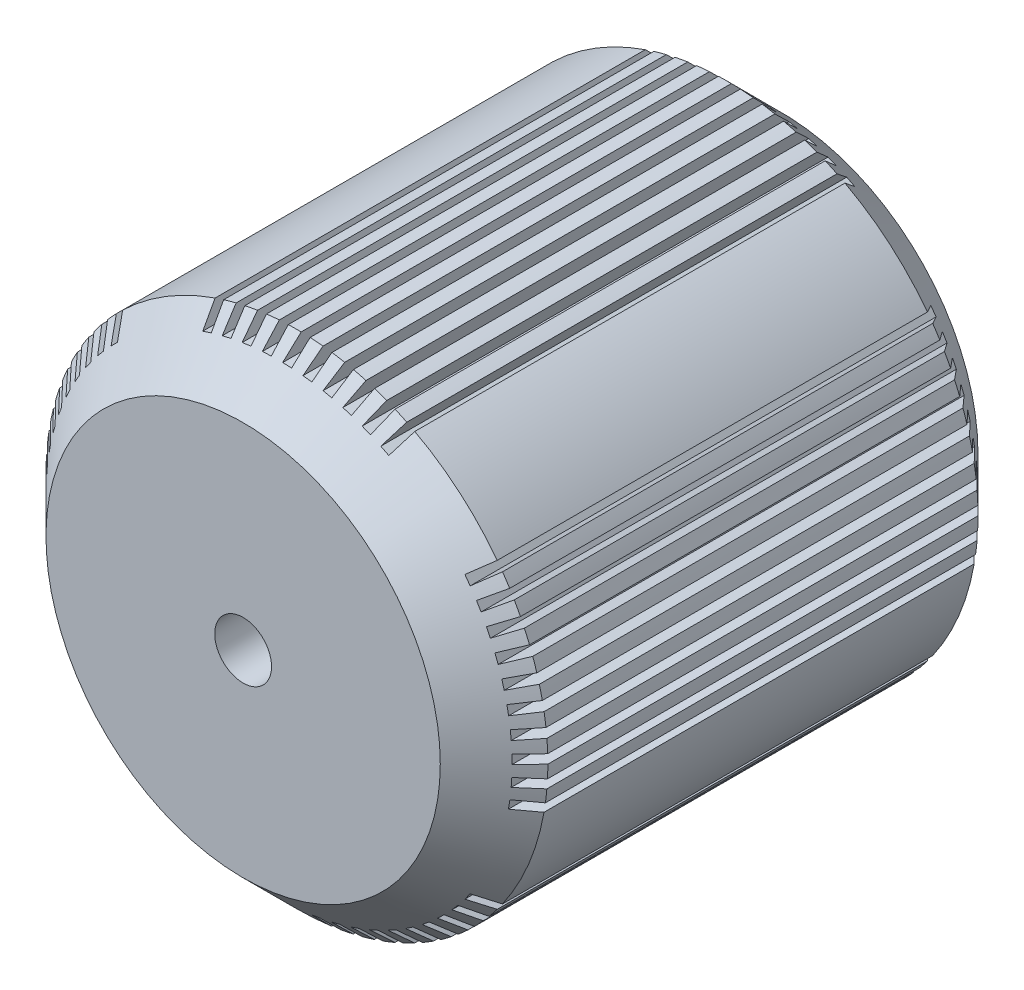
from build123d import *

# Parameters (mm, degrees)
ESQUISSE1_R                          = 14
BOSS_EXTRU_1_DEPTH                   = 30
CHANFREIN1_SIZE                      = 3
ESQUISSE2_R                          = 1.585
ENL_V_MAT_EXTRU_1_DEPTH              = 20
ENL_V_MAT_EXTRU_6_DEPTH              = 36.944401511
R_P_TITION_CIRCULAIRE1_COUNT         = 10
R_P_TITION_CIRCULAIRE1_ANGLE         = 45
R_P_TITION_CIRCULAIRE2_COUNT         = 5
R_P_TITION_CIRCULAIRE2_COPY_1_DEPTH  = 36.944401511
R_P_TITION_CIRCULAIRE2_COPY_2_DEPTH  = 36.944401511
R_P_TITION_CIRCULAIRE2_COPY_3_DEPTH  = 36.944401511
R_P_TITION_CIRCULAIRE2_COPY_4_DEPTH  = 36.944401511
R_P_TITION_CIRCULAIRE2_COPY_5_DEPTH  = 36.944401511
R_P_TITION_CIRCULAIRE2_COPY_6_DEPTH  = 36.944401511
R_P_TITION_CIRCULAIRE2_COPY_7_DEPTH  = 36.944401511
R_P_TITION_CIRCULAIRE2_COPY_8_DEPTH  = 36.944401511
R_P_TITION_CIRCULAIRE2_COPY_9_DEPTH  = 36.944401511
R_P_TITION_CIRCULAIRE2_COPY_10_DEPTH = 36.944401511
R_P_TITION_CIRCULAIRE2_COPY_11_DEPTH = 36.944401511
R_P_TITION_CIRCULAIRE2_COPY_12_DEPTH = 36.944401511
R_P_TITION_CIRCULAIRE2_COPY_13_DEPTH = 36.944401511
R_P_TITION_CIRCULAIRE2_COPY_14_DEPTH = 36.944401511
R_P_TITION_CIRCULAIRE2_COPY_15_DEPTH = 36.944401511
R_P_TITION_CIRCULAIRE2_COPY_16_DEPTH = 36.944401511
R_P_TITION_CIRCULAIRE2_COPY_17_DEPTH = 36.944401511
R_P_TITION_CIRCULAIRE2_COPY_18_DEPTH = 36.944401511
R_P_TITION_CIRCULAIRE2_COPY_19_DEPTH = 36.944401511
R_P_TITION_CIRCULAIRE2_COPY_20_DEPTH = 36.944401511
R_P_TITION_CIRCULAIRE2_COPY_21_DEPTH = 36.944401511
R_P_TITION_CIRCULAIRE2_COPY_22_DEPTH = 36.944401511
R_P_TITION_CIRCULAIRE2_COPY_23_DEPTH = 36.944401511
R_P_TITION_CIRCULAIRE2_COPY_24_DEPTH = 36.944401511
R_P_TITION_CIRCULAIRE2_COPY_25_DEPTH = 36.944401511
R_P_TITION_CIRCULAIRE2_COPY_26_DEPTH = 36.944401511
R_P_TITION_CIRCULAIRE2_COPY_27_DEPTH = 36.944401511
R_P_TITION_CIRCULAIRE2_COPY_28_DEPTH = 36.944401511
R_P_TITION_CIRCULAIRE2_COPY_29_DEPTH = 36.944401511
R_P_TITION_CIRCULAIRE2_COPY_30_DEPTH = 36.944401511
R_P_TITION_CIRCULAIRE2_COPY_31_DEPTH = 36.944401511
R_P_TITION_CIRCULAIRE2_COPY_32_DEPTH = 36.944401511
R_P_TITION_CIRCULAIRE2_COPY_33_DEPTH = 36.944401511
R_P_TITION_CIRCULAIRE2_COPY_34_DEPTH = 36.944401511
R_P_TITION_CIRCULAIRE2_COPY_35_DEPTH = 36.944401511
R_P_TITION_CIRCULAIRE2_COPY_36_DEPTH = 36.944401511


with BuildPart() as part:
    # Esquisse1 → Boss.-Extru.1 (new body)
    with BuildSketch(Plane.XY):
        Circle(ESQUISSE1_R)
    extrude(amount=BOSS_EXTRU_1_DEPTH)

    # Chanfrein1
    chanfrein1_edges = [part.edges().sort_by_distance(p)[0] for p in [
        (-14, 0, 0),
        (-14, 0, 30),
    ]]
    chamfer(chanfrein1_edges, length=CHANFREIN1_SIZE)

    # Esquisse2 → Enlèv. mat.-Extru.1 (cut)
    with BuildSketch(Plane.XY.offset(30)):
        Circle(ESQUISSE2_R)
    extrude(amount=-ENL_V_MAT_EXTRU_1_DEPTH, mode=Mode.SUBTRACT)

    # Esquisse3 → Enlèv. mat.-Extru.6 (cut, through all)
    with BuildSketch(Plane.XY.offset(30)):
        with BuildLine():
            Line((-14, 0.25), (-13, 0.25))
            Line((-13, 0.25), (-13, -0.25))
            Line((-13, -0.25), (-14, -0.25))
            ThreePointArc((-14, -0.25), (-14.007854256, 0), (-14, 0.25))
        make_face()
    enl_v_mat_extru_6 = extrude(amount=-ENL_V_MAT_EXTRU_6_DEPTH, mode=Mode.SUBTRACT)

    # Répétition circulaire1: Enlèv. mat.-Extru.6 ×10 about axis
    r_p_tition_circulaire1_axis = Axis((0, 0, 0), (0, 0, -1))
    for i in range(1, R_P_TITION_CIRCULAIRE1_COUNT):
        add(enl_v_mat_extru_6.rotate(r_p_tition_circulaire1_axis, i * R_P_TITION_CIRCULAIRE1_ANGLE / (R_P_TITION_CIRCULAIRE1_COUNT - 1)), mode=Mode.SUBTRACT)

    # Répétition circulaire2: Enlèv. mat.-Extru.6 ×5 about axis
    r_p_tition_circulaire2_axis = Axis((0, 0, 0), (0, 0, 1))
    for i in range(1, R_P_TITION_CIRCULAIRE2_COUNT):
        add(enl_v_mat_extru_6.rotate(r_p_tition_circulaire2_axis, i * 360 / R_P_TITION_CIRCULAIRE2_COUNT), mode=Mode.SUBTRACT)

    # Répétition circulaire2 copy 1 sketch → Répétition circulaire2 copy 1 (cut, through all)
    with BuildSketch(Plane(origin=(0, 0, 30), x_dir=(0.39073112848927394, 0.9205048534524402, 0), z_dir=(0, 0, 1))):
        with BuildLine():
            Line((-14, 0.25), (-13, 0.25))
            Line((-13, 0.25), (-13, -0.25))
            Line((-13, -0.25), (-14, -0.25))
            ThreePointArc((-14, -0.25), (-14.007854256, 0), (-14, 0.25))
        make_face()
    extrude(amount=-R_P_TITION_CIRCULAIRE2_COPY_1_DEPTH, mode=Mode.SUBTRACT)

    # Répétition circulaire2 copy 2 sketch → Répétition circulaire2 copy 2 (cut, through all)
    with BuildSketch(Plane(origin=(0, 0, 30), x_dir=(-0.7547095802227719, 0.6560590289905076, 0), z_dir=(0, 0, 1))):
        with BuildLine():
            Line((-14, 0.25), (-13, 0.25))
            Line((-13, 0.25), (-13, -0.25))
            Line((-13, -0.25), (-14, -0.25))
            ThreePointArc((-14, -0.25), (-14.007854256, 0), (-14, 0.25))
        make_face()
    extrude(amount=-R_P_TITION_CIRCULAIRE2_COPY_2_DEPTH, mode=Mode.SUBTRACT)

    # Répétition circulaire2 copy 3 sketch → Répétition circulaire2 copy 3 (cut, through all)
    with BuildSketch(Plane(origin=(0, 0, 30), x_dir=(-0.8571673007021126, -0.5150380749100539, 0), z_dir=(0, 0, 1))):
        with BuildLine():
            Line((-14, 0.25), (-13, 0.25))
            Line((-13, 0.25), (-13, -0.25))
            Line((-13, -0.25), (-14, -0.25))
            ThreePointArc((-14, -0.25), (-14.007854256, 0), (-14, 0.25))
        make_face()
    extrude(amount=-R_P_TITION_CIRCULAIRE2_COPY_3_DEPTH, mode=Mode.SUBTRACT)

    # Répétition circulaire2 copy 4 sketch → Répétition circulaire2 copy 4 (cut, through all)
    with BuildSketch(Plane(origin=(0, 0, 30), x_dir=(0.2249510543438646, -0.9743700647852354, 0), z_dir=(0, 0, 1))):
        with BuildLine():
            Line((-14, 0.25), (-13, 0.25))
            Line((-13, 0.25), (-13, -0.25))
            Line((-13, -0.25), (-14, -0.25))
            ThreePointArc((-14, -0.25), (-14.007854256, 0), (-14, 0.25))
        make_face()
    extrude(amount=-R_P_TITION_CIRCULAIRE2_COPY_4_DEPTH, mode=Mode.SUBTRACT)

    # Répétition circulaire2 copy 5 sketch → Répétition circulaire2 copy 5 (cut, through all)
    with BuildSketch(Plane(origin=(0, 0, 30), x_dir=(0.4694715627858912, 0.8829475928589268, 0), z_dir=(0, 0, 1))):
        with BuildLine():
            Line((-14, 0.25), (-13, 0.25))
            Line((-13, 0.25), (-13, -0.25))
            Line((-13, -0.25), (-14, -0.25))
            ThreePointArc((-14, -0.25), (-14.007854256, 0), (-14, 0.25))
        make_face()
    extrude(amount=-R_P_TITION_CIRCULAIRE2_COPY_5_DEPTH, mode=Mode.SUBTRACT)

    # Répétition circulaire2 copy 6 sketch → Répétition circulaire2 copy 6 (cut, through all)
    with BuildSketch(Plane(origin=(0, 0, 30), x_dir=(-0.6946583704589969, 0.7193398003386515, 0), z_dir=(0, 0, 1))):
        with BuildLine():
            Line((-14, 0.25), (-13, 0.25))
            Line((-13, 0.25), (-13, -0.25))
            Line((-13, -0.25), (-14, -0.25))
            ThreePointArc((-14, -0.25), (-14.007854256, 0), (-14, 0.25))
        make_face()
    extrude(amount=-R_P_TITION_CIRCULAIRE2_COPY_6_DEPTH, mode=Mode.SUBTRACT)

    # Répétition circulaire2 copy 7 sketch → Répétition circulaire2 copy 7 (cut, through all)
    with BuildSketch(Plane(origin=(0, 0, 30), x_dir=(-0.8987940462991674, -0.43837114678907696, 0), z_dir=(0, 0, 1))):
        with BuildLine():
            Line((-14, 0.25), (-13, 0.25))
            Line((-13, 0.25), (-13, -0.25))
            Line((-13, -0.25), (-14, -0.25))
            ThreePointArc((-14, -0.25), (-14.007854256, 0), (-14, 0.25))
        make_face()
    extrude(amount=-R_P_TITION_CIRCULAIRE2_COPY_7_DEPTH, mode=Mode.SUBTRACT)

    # Répétition circulaire2 copy 8 sketch → Répétition circulaire2 copy 8 (cut, through all)
    with BuildSketch(Plane(origin=(0, 0, 30), x_dir=(0.13917310096006485, -0.9902680687415705, 0), z_dir=(0, 0, 1))):
        with BuildLine():
            Line((-14, 0.25), (-13, 0.25))
            Line((-13, 0.25), (-13, -0.25))
            Line((-13, -0.25), (-14, -0.25))
            ThreePointArc((-14, -0.25), (-14.007854256, 0), (-14, 0.25))
        make_face()
    extrude(amount=-R_P_TITION_CIRCULAIRE2_COPY_8_DEPTH, mode=Mode.SUBTRACT)

    # Répétition circulaire2 copy 9 sketch → Répétition circulaire2 copy 9 (cut, through all)
    with BuildSketch(Plane(origin=(0, 0, 30), x_dir=(0.5446390350150276, 0.8386705679454236, 0), z_dir=(0, 0, 1))):
        with BuildLine():
            Line((-14, 0.25), (-13, 0.25))
            Line((-13, 0.25), (-13, -0.25))
            Line((-13, -0.25), (-14, -0.25))
            ThreePointArc((-14, -0.25), (-14.007854256, 0), (-14, 0.25))
        make_face()
    extrude(amount=-R_P_TITION_CIRCULAIRE2_COPY_9_DEPTH, mode=Mode.SUBTRACT)

    # Répétition circulaire2 copy 10 sketch → Répétition circulaire2 copy 10 (cut, through all)
    with BuildSketch(Plane(origin=(0, 0, 30), x_dir=(-0.6293203910498368, 0.7771459614569713, 0), z_dir=(0, 0, 1))):
        with BuildLine():
            Line((-14, 0.25), (-13, 0.25))
            Line((-13, 0.25), (-13, -0.25))
            Line((-13, -0.25), (-14, -0.25))
            ThreePointArc((-14, -0.25), (-14.007854256, 0), (-14, 0.25))
        make_face()
    extrude(amount=-R_P_TITION_CIRCULAIRE2_COPY_10_DEPTH, mode=Mode.SUBTRACT)

    # Répétition circulaire2 copy 11 sketch → Répétition circulaire2 copy 11 (cut, through all)
    with BuildSketch(Plane(origin=(0, 0, 30), x_dir=(-0.9335804264972021, -0.3583679495452995, 0), z_dir=(0, 0, 1))):
        with BuildLine():
            Line((-14, 0.25), (-13, 0.25))
            Line((-13, 0.25), (-13, -0.25))
            Line((-13, -0.25), (-14, -0.25))
            ThreePointArc((-14, -0.25), (-14.007854256, 0), (-14, 0.25))
        make_face()
    extrude(amount=-R_P_TITION_CIRCULAIRE2_COPY_11_DEPTH, mode=Mode.SUBTRACT)

    # Répétition circulaire2 copy 12 sketch → Répétition circulaire2 copy 12 (cut, through all)
    with BuildSketch(Plane(origin=(0, 0, 30), x_dir=(0.05233595624294293, -0.9986295347545739, 0), z_dir=(0, 0, 1))):
        with BuildLine():
            Line((-14, 0.25), (-13, 0.25))
            Line((-13, 0.25), (-13, -0.25))
            Line((-13, -0.25), (-14, -0.25))
            ThreePointArc((-14, -0.25), (-14.007854256, 0), (-14, 0.25))
        make_face()
    extrude(amount=-R_P_TITION_CIRCULAIRE2_COPY_12_DEPTH, mode=Mode.SUBTRACT)

    # Répétition circulaire2 copy 13 sketch → Répétition circulaire2 copy 13 (cut, through all)
    with BuildSketch(Plane(origin=(0, 0, 30), x_dir=(0.6156614753256588, 0.7880107536067213, 0), z_dir=(0, 0, 1))):
        with BuildLine():
            Line((-14, 0.25), (-13, 0.25))
            Line((-13, 0.25), (-13, -0.25))
            Line((-13, -0.25), (-14, -0.25))
            ThreePointArc((-14, -0.25), (-14.007854256, 0), (-14, 0.25))
        make_face()
    extrude(amount=-R_P_TITION_CIRCULAIRE2_COPY_13_DEPTH, mode=Mode.SUBTRACT)

    # Répétition circulaire2 copy 14 sketch → Répétition circulaire2 copy 14 (cut, through all)
    with BuildSketch(Plane(origin=(0, 0, 30), x_dir=(-0.559192903470746, 0.8290375725550422, 0), z_dir=(0, 0, 1))):
        with BuildLine():
            Line((-14, 0.25), (-13, 0.25))
            Line((-13, 0.25), (-13, -0.25))
            Line((-13, -0.25), (-14, -0.25))
            ThreePointArc((-14, -0.25), (-14.007854256, 0), (-14, 0.25))
        make_face()
    extrude(amount=-R_P_TITION_CIRCULAIRE2_COPY_14_DEPTH, mode=Mode.SUBTRACT)

    # Répétition circulaire2 copy 15 sketch → Répétition circulaire2 copy 15 (cut, through all)
    with BuildSketch(Plane(origin=(0, 0, 30), x_dir=(-0.9612616959383191, -0.2756373558169982, 0), z_dir=(0, 0, 1))):
        with BuildLine():
            Line((-14, 0.25), (-13, 0.25))
            Line((-13, 0.25), (-13, -0.25))
            Line((-13, -0.25), (-14, -0.25))
            ThreePointArc((-14, -0.25), (-14.007854256, 0), (-14, 0.25))
        make_face()
    extrude(amount=-R_P_TITION_CIRCULAIRE2_COPY_15_DEPTH, mode=Mode.SUBTRACT)

    # Répétition circulaire2 copy 16 sketch → Répétition circulaire2 copy 16 (cut, through all)
    with BuildSketch(Plane(origin=(0, 0, 30), x_dir=(-0.034899496702501975, -0.9993908270190957, 0), z_dir=(0, 0, 1))):
        with BuildLine():
            Line((-14, 0.25), (-13, 0.25))
            Line((-13, 0.25), (-13, -0.25))
            Line((-13, -0.25), (-14, -0.25))
            ThreePointArc((-14, -0.25), (-14.007854256, 0), (-14, 0.25))
        make_face()
    extrude(amount=-R_P_TITION_CIRCULAIRE2_COPY_16_DEPTH, mode=Mode.SUBTRACT)

    # Répétition circulaire2 copy 17 sketch → Répétition circulaire2 copy 17 (cut, through all)
    with BuildSketch(Plane(origin=(0, 0, 30), x_dir=(0.6819983600624993, 0.7313537016191697, 0), z_dir=(0, 0, 1))):
        with BuildLine():
            Line((-14, 0.25), (-13, 0.25))
            Line((-13, 0.25), (-13, -0.25))
            Line((-13, -0.25), (-14, -0.25))
            ThreePointArc((-14, -0.25), (-14.007854256, 0), (-14, 0.25))
        make_face()
    extrude(amount=-R_P_TITION_CIRCULAIRE2_COPY_17_DEPTH, mode=Mode.SUBTRACT)

    # Répétition circulaire2 copy 18 sketch → Répétition circulaire2 copy 18 (cut, through all)
    with BuildSketch(Plane(origin=(0, 0, 30), x_dir=(-0.484809620246336, 0.8746197071393964, 0), z_dir=(0, 0, 1))):
        with BuildLine():
            Line((-14, 0.25), (-13, 0.25))
            Line((-13, 0.25), (-13, -0.25))
            Line((-13, -0.25), (-14, -0.25))
            ThreePointArc((-14, -0.25), (-14.007854256, 0), (-14, 0.25))
        make_face()
    extrude(amount=-R_P_TITION_CIRCULAIRE2_COPY_18_DEPTH, mode=Mode.SUBTRACT)

    # Répétition circulaire2 copy 19 sketch → Répétition circulaire2 copy 19 (cut, through all)
    with BuildSketch(Plane(origin=(0, 0, 30), x_dir=(-0.9816271834476642, -0.19080899537654367, 0), z_dir=(0, 0, 1))):
        with BuildLine():
            Line((-14, 0.25), (-13, 0.25))
            Line((-13, 0.25), (-13, -0.25))
            Line((-13, -0.25), (-14, -0.25))
            ThreePointArc((-14, -0.25), (-14.007854256, 0), (-14, 0.25))
        make_face()
    extrude(amount=-R_P_TITION_CIRCULAIRE2_COPY_19_DEPTH, mode=Mode.SUBTRACT)

    # Répétition circulaire2 copy 20 sketch → Répétition circulaire2 copy 20 (cut, through all)
    with BuildSketch(Plane(origin=(0, 0, 30), x_dir=(-0.12186934340514866, -0.9925461516413218, 0), z_dir=(0, 0, 1))):
        with BuildLine():
            Line((-14, 0.25), (-13, 0.25))
            Line((-13, 0.25), (-13, -0.25))
            Line((-13, -0.25), (-14, -0.25))
            ThreePointArc((-14, -0.25), (-14.007854256, 0), (-14, 0.25))
        make_face()
    extrude(amount=-R_P_TITION_CIRCULAIRE2_COPY_20_DEPTH, mode=Mode.SUBTRACT)

    # Répétition circulaire2 copy 21 sketch → Répétition circulaire2 copy 21 (cut, through all)
    with BuildSketch(Plane(origin=(0, 0, 30), x_dir=(0.7431448254773951, 0.6691306063588572, 0), z_dir=(0, 0, 1))):
        with BuildLine():
            Line((-14, 0.25), (-13, 0.25))
            Line((-13, 0.25), (-13, -0.25))
            Line((-13, -0.25), (-14, -0.25))
            ThreePointArc((-14, -0.25), (-14.007854256, 0), (-14, 0.25))
        make_face()
    extrude(amount=-R_P_TITION_CIRCULAIRE2_COPY_21_DEPTH, mode=Mode.SUBTRACT)

    # Répétition circulaire2 copy 22 sketch → Répétition circulaire2 copy 22 (cut, through all)
    with BuildSketch(Plane(origin=(0, 0, 30), x_dir=(-0.4067366430757989, 0.9135454576426014, 0), z_dir=(0, 0, 1))):
        with BuildLine():
            Line((-14, 0.25), (-13, 0.25))
            Line((-13, 0.25), (-13, -0.25))
            Line((-13, -0.25), (-14, -0.25))
            ThreePointArc((-14, -0.25), (-14.007854256, 0), (-14, 0.25))
        make_face()
    extrude(amount=-R_P_TITION_CIRCULAIRE2_COPY_22_DEPTH, mode=Mode.SUBTRACT)

    # Répétition circulaire2 copy 23 sketch → Répétition circulaire2 copy 23 (cut, through all)
    with BuildSketch(Plane(origin=(0, 0, 30), x_dir=(-0.9945218953682735, -0.10452846326765203, 0), z_dir=(0, 0, 1))):
        with BuildLine():
            Line((-14, 0.25), (-13, 0.25))
            Line((-13, 0.25), (-13, -0.25))
            Line((-13, -0.25), (-14, -0.25))
            ThreePointArc((-14, -0.25), (-14.007854256, 0), (-14, 0.25))
        make_face()
    extrude(amount=-R_P_TITION_CIRCULAIRE2_COPY_23_DEPTH, mode=Mode.SUBTRACT)

    # Répétition circulaire2 copy 24 sketch → Répétition circulaire2 copy 24 (cut, through all)
    with BuildSketch(Plane(origin=(0, 0, 30), x_dir=(-0.20791169081776079, -0.9781476007338054, 0), z_dir=(0, 0, 1))):
        with BuildLine():
            Line((-14, 0.25), (-13, 0.25))
            Line((-13, 0.25), (-13, -0.25))
            Line((-13, -0.25), (-14, -0.25))
            ThreePointArc((-14, -0.25), (-14.007854256, 0), (-14, 0.25))
        make_face()
    extrude(amount=-R_P_TITION_CIRCULAIRE2_COPY_24_DEPTH, mode=Mode.SUBTRACT)

    # Répétition circulaire2 copy 25 sketch → Répétition circulaire2 copy 25 (cut, through all)
    with BuildSketch(Plane(origin=(0, 0, 30), x_dir=(0.7986355100472937, 0.6018150231520472, 0), z_dir=(0, 0, 1))):
        with BuildLine():
            Line((-14, 0.25), (-13, 0.25))
            Line((-13, 0.25), (-13, -0.25))
            Line((-13, -0.25), (-14, -0.25))
            ThreePointArc((-14, -0.25), (-14.007854256, 0), (-14, 0.25))
        make_face()
    extrude(amount=-R_P_TITION_CIRCULAIRE2_COPY_25_DEPTH, mode=Mode.SUBTRACT)

    # Répétition circulaire2 copy 26 sketch → Répétition circulaire2 copy 26 (cut, through all)
    with BuildSketch(Plane(origin=(0, 0, 30), x_dir=(-0.32556815445715526, 0.9455185755993174, 0), z_dir=(0, 0, 1))):
        with BuildLine():
            Line((-14, 0.25), (-13, 0.25))
            Line((-13, 0.25), (-13, -0.25))
            Line((-13, -0.25), (-14, -0.25))
            ThreePointArc((-14, -0.25), (-14.007854256, 0), (-14, 0.25))
        make_face()
    extrude(amount=-R_P_TITION_CIRCULAIRE2_COPY_26_DEPTH, mode=Mode.SUBTRACT)

    # Répétition circulaire2 copy 27 sketch → Répétition circulaire2 copy 27 (cut, through all)
    with BuildSketch(Plane(origin=(0, 0, 30), x_dir=(-0.9998476951563913, -0.017452406437281964, 0), z_dir=(0, 0, 1))):
        with BuildLine():
            Line((-14, 0.25), (-13, 0.25))
            Line((-13, 0.25), (-13, -0.25))
            Line((-13, -0.25), (-14, -0.25))
            ThreePointArc((-14, -0.25), (-14.007854256, 0), (-14, 0.25))
        make_face()
    extrude(amount=-R_P_TITION_CIRCULAIRE2_COPY_27_DEPTH, mode=Mode.SUBTRACT)

    # Répétition circulaire2 copy 28 sketch → Répétition circulaire2 copy 28 (cut, through all)
    with BuildSketch(Plane(origin=(0, 0, 30), x_dir=(-0.29237170472273827, -0.9563047559630351, 0), z_dir=(0, 0, 1))):
        with BuildLine():
            Line((-14, 0.25), (-13, 0.25))
            Line((-13, 0.25), (-13, -0.25))
            Line((-13, -0.25), (-14, -0.25))
            ThreePointArc((-14, -0.25), (-14.007854256, 0), (-14, 0.25))
        make_face()
    extrude(amount=-R_P_TITION_CIRCULAIRE2_COPY_28_DEPTH, mode=Mode.SUBTRACT)

    # Répétition circulaire2 copy 29 sketch → Répétition circulaire2 copy 29 (cut, through all)
    with BuildSketch(Plane(origin=(0, 0, 30), x_dir=(0.8480480961564267, 0.5299192642332036, 0), z_dir=(0, 0, 1))):
        with BuildLine():
            Line((-14, 0.25), (-13, 0.25))
            Line((-13, 0.25), (-13, -0.25))
            Line((-13, -0.25), (-14, -0.25))
            ThreePointArc((-14, -0.25), (-14.007854256, 0), (-14, 0.25))
        make_face()
    extrude(amount=-R_P_TITION_CIRCULAIRE2_COPY_29_DEPTH, mode=Mode.SUBTRACT)

    # Répétition circulaire2 copy 30 sketch → Répétition circulaire2 copy 30 (cut, through all)
    with BuildSketch(Plane(origin=(0, 0, 30), x_dir=(-0.24192189559966604, 0.970295726275997, 0), z_dir=(0, 0, 1))):
        with BuildLine():
            Line((-14, 0.25), (-13, 0.25))
            Line((-13, 0.25), (-13, -0.25))
            Line((-13, -0.25), (-14, -0.25))
            ThreePointArc((-14, -0.25), (-14.007854256, 0), (-14, 0.25))
        make_face()
    extrude(amount=-R_P_TITION_CIRCULAIRE2_COPY_30_DEPTH, mode=Mode.SUBTRACT)

    # Répétition circulaire2 copy 31 sketch → Répétition circulaire2 copy 31 (cut, through all)
    with BuildSketch(Plane(origin=(0, 0, 30), x_dir=(-0.9975640502598242, 0.06975647374412708, 0), z_dir=(0, 0, 1))):
        with BuildLine():
            Line((-14, 0.25), (-13, 0.25))
            Line((-13, 0.25), (-13, -0.25))
            Line((-13, -0.25), (-14, -0.25))
            ThreePointArc((-14, -0.25), (-14.007854256, 0), (-14, 0.25))
        make_face()
    extrude(amount=-R_P_TITION_CIRCULAIRE2_COPY_31_DEPTH, mode=Mode.SUBTRACT)

    # Répétition circulaire2 copy 32 sketch → Répétition circulaire2 copy 32 (cut, through all)
    with BuildSketch(Plane(origin=(0, 0, 30), x_dir=(-0.37460659341591374, -0.9271838545667868, 0), z_dir=(0, 0, 1))):
        with BuildLine():
            Line((-14, 0.25), (-13, 0.25))
            Line((-13, 0.25), (-13, -0.25))
            Line((-13, -0.25), (-14, -0.25))
            ThreePointArc((-14, -0.25), (-14.007854256, 0), (-14, 0.25))
        make_face()
    extrude(amount=-R_P_TITION_CIRCULAIRE2_COPY_32_DEPTH, mode=Mode.SUBTRACT)

    # Répétition circulaire2 copy 33 sketch → Répétition circulaire2 copy 33 (cut, through all)
    with BuildSketch(Plane(origin=(0, 0, 30), x_dir=(0.8910065241883687, 0.4539904997395451, 0), z_dir=(0, 0, 1))):
        with BuildLine():
            Line((-14, 0.25), (-13, 0.25))
            Line((-13, 0.25), (-13, -0.25))
            Line((-13, -0.25), (-14, -0.25))
            ThreePointArc((-14, -0.25), (-14.007854256, 0), (-14, 0.25))
        make_face()
    extrude(amount=-R_P_TITION_CIRCULAIRE2_COPY_33_DEPTH, mode=Mode.SUBTRACT)

    # Répétition circulaire2 copy 34 sketch → Répétition circulaire2 copy 34 (cut, through all)
    with BuildSketch(Plane(origin=(0, 0, 30), x_dir=(-0.156434465040229, 0.987688340595138, 0), z_dir=(0, 0, 1))):
        with BuildLine():
            Line((-14, 0.25), (-13, 0.25))
            Line((-13, 0.25), (-13, -0.25))
            Line((-13, -0.25), (-14, -0.25))
            ThreePointArc((-14, -0.25), (-14.007854256, 0), (-14, 0.25))
        make_face()
    extrude(amount=-R_P_TITION_CIRCULAIRE2_COPY_34_DEPTH, mode=Mode.SUBTRACT)

    # Répétition circulaire2 copy 35 sketch → Répétition circulaire2 copy 35 (cut, through all)
    with BuildSketch(Plane(origin=(0, 0, 30), x_dir=(-0.9876883405951374, 0.1564344650402329, 0), z_dir=(0, 0, 1))):
        with BuildLine():
            Line((-14, 0.25), (-13, 0.25))
            Line((-13, 0.25), (-13, -0.25))
            Line((-13, -0.25), (-14, -0.25))
            ThreePointArc((-14, -0.25), (-14.007854256, 0), (-14, 0.25))
        make_face()
    extrude(amount=-R_P_TITION_CIRCULAIRE2_COPY_35_DEPTH, mode=Mode.SUBTRACT)

    # Répétition circulaire2 copy 36 sketch → Répétition circulaire2 copy 36 (cut, through all)
    with BuildSketch(Plane(origin=(0, 0, 30), x_dir=(-0.45399049973954864, -0.8910065241883669, 0), z_dir=(0, 0, 1))):
        with BuildLine():
            Line((-14, 0.25), (-13, 0.25))
            Line((-13, 0.25), (-13, -0.25))
            Line((-13, -0.25), (-14, -0.25))
            ThreePointArc((-14, -0.25), (-14.007854256, 0), (-14, 0.25))
        make_face()
    extrude(amount=-R_P_TITION_CIRCULAIRE2_COPY_36_DEPTH, mode=Mode.SUBTRACT)


solid = part.part
